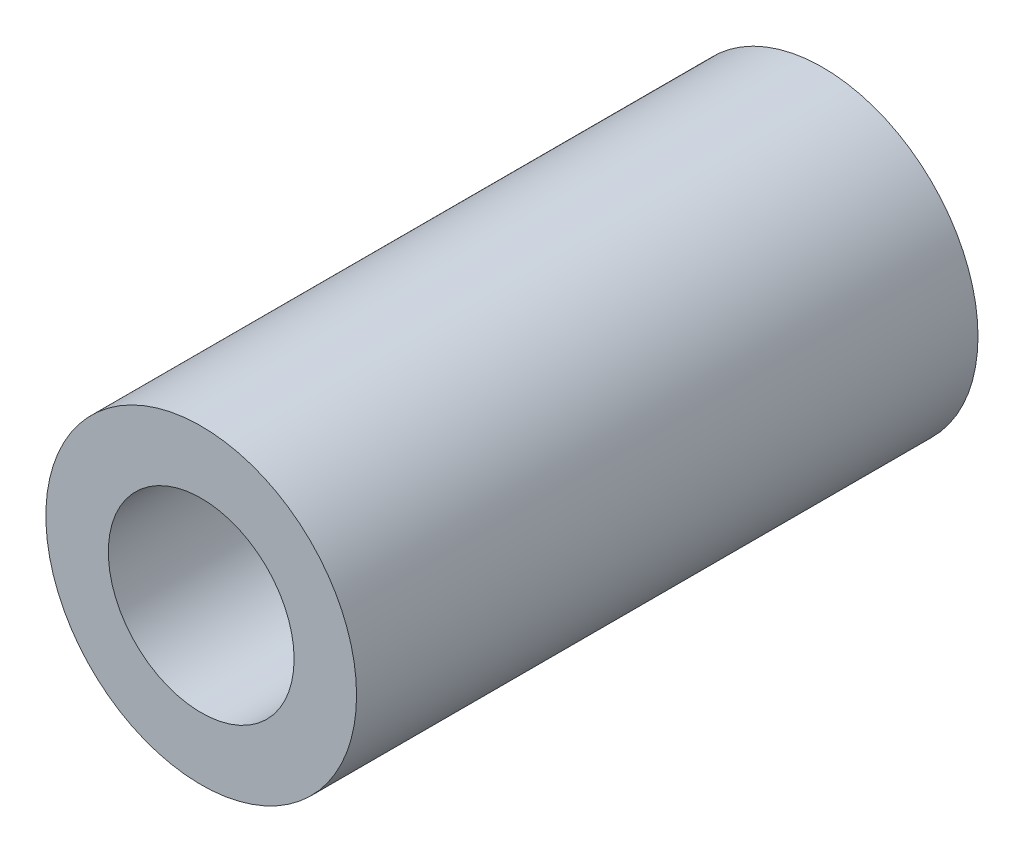
from build123d import *

# Parameters (mm, degrees)
SKETCH1_R           = 3.175
SKETCH1_R_2         = 1.89865
BOSS_EXTRUDE1_DEPTH = 12.7


with BuildPart() as part:
    # Sketch1 → Boss-Extrude1 (new body)
    with BuildSketch(Plane.XY):
        Circle(SKETCH1_R)
        Circle(SKETCH1_R_2, mode=Mode.SUBTRACT)
    extrude(amount=BOSS_EXTRUDE1_DEPTH)


solid = part.part
